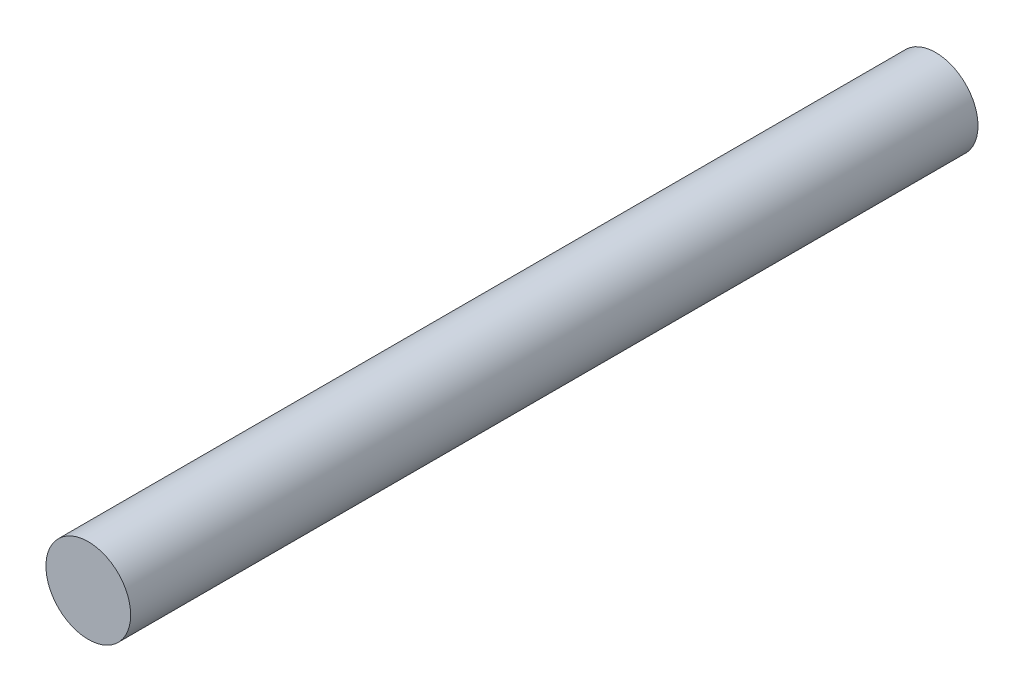
from build123d import *

# Parameters (mm, degrees)
SZKIC1_R                    = 2.5
DODANIE_WYCI_GNI_CIE1_DEPTH = 50


with BuildPart() as part:
    # Szkic1 → Dodanie-wyciągnięcie1 (new body)
    with BuildSketch(Plane.XY):
        Circle(SZKIC1_R)
    extrude(amount=DODANIE_WYCI_GNI_CIE1_DEPTH)


solid = part.part
